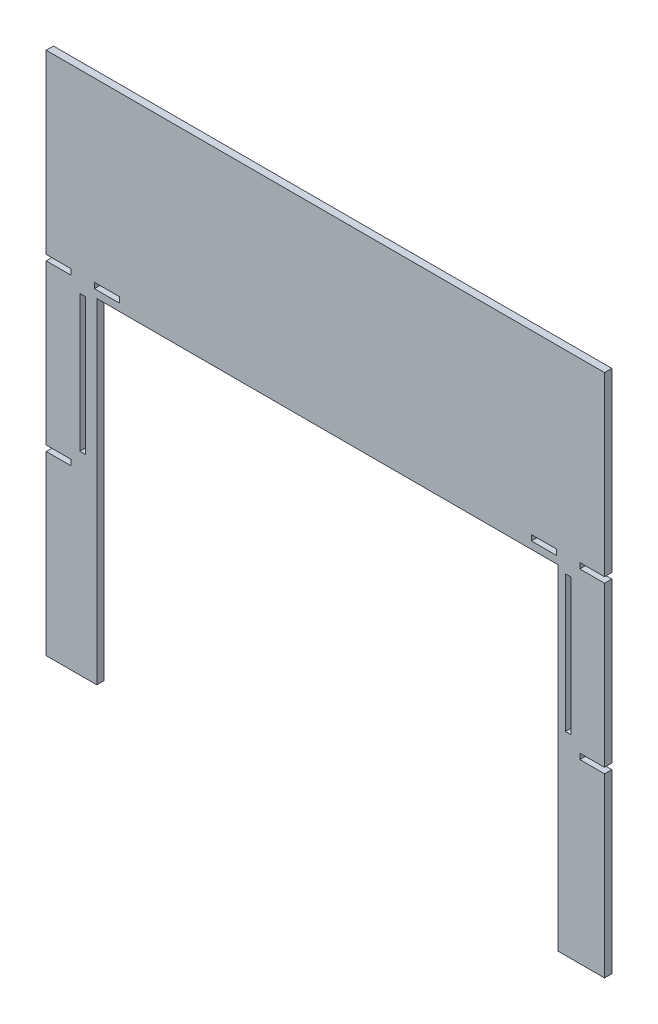
from build123d import *

# Parameters (mm, degrees)
SKETCH2_W           = 230
SKETCH2_H           = 216
BOSS_EXTRUDE1_DEPTH = 3
SKETCH5_W           = 190
SKETCH5_H           = 137.85
SKETCH5_W_2         = 10.3
SKETCH5_H_2         = 2.3
SKETCH5_W_3         = 2.3
SKETCH5_H_3         = 56.3
CUT_EXTRUDE3_DEPTH  = 3


with BuildPart() as part:
    # Sketch2 → Boss-Extrude1 (new body)
    with BuildSketch(Plane.XY.offset(184)):
        with Locations((-57.5, 0)):
            Rectangle(SKETCH2_W, SKETCH2_H)
    extrude(amount=BOSS_EXTRUDE1_DEPTH)

    # Sketch5 → Cut-Extrude3 (cut)
    with BuildSketch(Plane.XY.offset(187)):
        with Locations((-56.65, -39.075)):
            Rectangle(SKETCH5_W, SKETCH5_H)
        with Locations((32.5, 34)):
            Rectangle(SKETCH5_W_2, SKETCH5_H_2)
        with Locations((52.5, 34)):
            Rectangle(SKETCH5_W_2, SKETCH5_H_2)
        with Locations((42.5, 0)):
            Rectangle(SKETCH5_W_3, SKETCH5_H_3)
        with Locations((52.5, -34)):
            Rectangle(SKETCH5_W_2, SKETCH5_H_2)
        with Locations((-157.5, 0)):
            Rectangle(SKETCH5_W_3, SKETCH5_H_3)
        with Locations((-147.5, 34)):
            Rectangle(SKETCH5_W_2, SKETCH5_H_2)
        with Locations((-167.5, 34)):
            Rectangle(SKETCH5_W_2, SKETCH5_H_2)
        with Locations((-167.5, -34)):
            Rectangle(SKETCH5_W_2, SKETCH5_H_2)
    extrude(amount=-CUT_EXTRUDE3_DEPTH, mode=Mode.SUBTRACT)


solid = part.part
